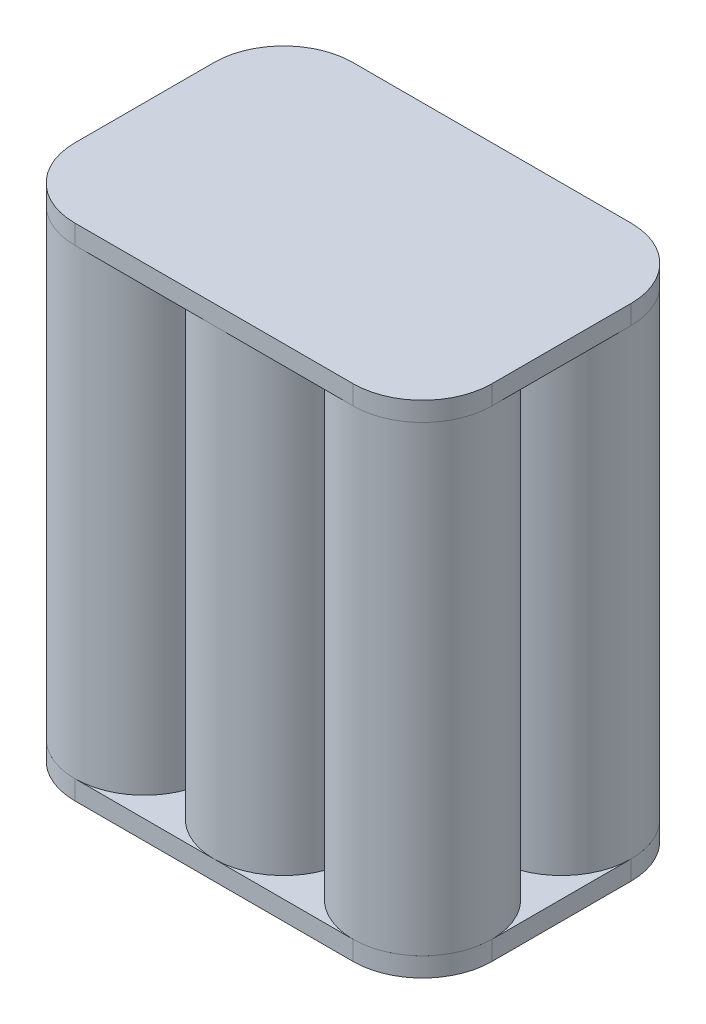
from build123d import *

# Parameters (mm, degrees)
SKETCH1_R             = 7.223333333
BOSS_EXTRUDE1_DEPTH   = 52
BOSS_EXTRUDE1_2_DEPTH = 52
BOSS_EXTRUDE1_3_DEPTH = 52
BOSS_EXTRUDE1_4_DEPTH = 52
BOSS_EXTRUDE1_5_DEPTH = 52
BOSS_EXTRUDE1_6_DEPTH = 52
SKETCH2_W             = 43.346666666
SKETCH2_H             = 28.896666666
BOSS_EXTRUDE2_DEPTH   = 2
SKETCH3_W             = 43.346666666
SKETCH3_H             = 28.896666666
BOSS_EXTRUDE3_DEPTH   = 2
FILLET1_R             = 7.22


with BuildPart() as part:
    # Sketch1 → Boss-Extrude1 (new body)
    with BuildSketch(Plane(origin=(0, 0, 0), x_dir=(1, 0, 0), z_dir=(0, 1, 0))):
        with Locations(Location((0, 0, 0), (0, 0, 90))):
            Circle(SKETCH1_R)
    extrude(amount=BOSS_EXTRUDE1_DEPTH)



with BuildPart() as body_2:
    # Sketch1 → Boss-Extrude1 2 (new body)
    with BuildSketch(Plane(origin=(0, 0, 0), x_dir=(1, 0, 0), z_dir=(0, 1, 0))):
        with Locations(Location((14.45, 0, 0), (0, 0, 90))):
            Circle(SKETCH1_R)
    extrude(amount=BOSS_EXTRUDE1_2_DEPTH)


with BuildPart() as body_3:
    # Sketch1 → Boss-Extrude1 3 (new body)
    with BuildSketch(Plane(origin=(0, 0, 0), x_dir=(1, 0, 0), z_dir=(0, 1, 0))):
        with Locations(Location((28.9, 0, 0), (0, 0, 90))):
            Circle(SKETCH1_R)
    extrude(amount=BOSS_EXTRUDE1_3_DEPTH)


with BuildPart() as body_4:
    # Sketch1 → Boss-Extrude1 4 (new body)
    with BuildSketch(Plane(origin=(0, 0, 0), x_dir=(1, 0, 0), z_dir=(0, 1, 0))):
        with Locations(Location((14.45, 14.45, 0), (0, 0, 90))):
            Circle(SKETCH1_R)
    extrude(amount=BOSS_EXTRUDE1_4_DEPTH)


with BuildPart() as body_5:
    # Sketch1 → Boss-Extrude1 5 (new body)
    with BuildSketch(Plane(origin=(0, 0, 0), x_dir=(1, 0, 0), z_dir=(0, 1, 0))):
        with Locations(Location((28.9, 14.45, 0), (0, 0, 90))):
            Circle(SKETCH1_R)
    extrude(amount=BOSS_EXTRUDE1_5_DEPTH)


with BuildPart() as body_6:
    # Sketch1 → Boss-Extrude1 6 (new body)
    with BuildSketch(Plane(origin=(0, 0, 0), x_dir=(1, 0, 0), z_dir=(0, 1, 0))):
        with Locations(Location((0, 14.45, 0), (0, 0, 90))):
            Circle(SKETCH1_R)
    extrude(amount=BOSS_EXTRUDE1_6_DEPTH)


with BuildPart() as part_1:
    add(part.part)

    add(body_2.part)  # Boss-Extrude2 merges body 2

    add(body_3.part)  # Boss-Extrude2 merges body 3

    add(body_4.part)  # Boss-Extrude2 merges body 4

    add(body_5.part)  # Boss-Extrude2 merges body 5

    add(body_6.part)  # Boss-Extrude2 merges body 6
    # Sketch2 → Boss-Extrude2 (add)
    with BuildSketch(Plane(origin=(0, 52, 0), x_dir=(1, 0, 0), z_dir=(0, 1, 0))):
        with Locations((14.45, 7.225)):
            Rectangle(SKETCH2_W, SKETCH2_H)
    extrude(amount=-BOSS_EXTRUDE2_DEPTH)

    # Sketch3 → Boss-Extrude3 (add)
    with BuildSketch(Plane.XZ):
        with Locations((14.45, -7.225)):
            Rectangle(SKETCH3_W, SKETCH3_H)
    extrude(amount=-BOSS_EXTRUDE3_DEPTH)

    # Fillet1
    fillet1_edges = [part_1.edges().sort_by_distance(p)[0] for p in [
        (36.123333333, 51, 7.223333333),
        (36.123333333, 1, 7.223333333),
        (-7.223333333, 51, 7.223333333),
        (-7.223333333, 1, 7.223333333),
        (-7.223333333, 51, -21.673333333),
        (36.123333333, 51, -21.673333333),
        (36.123333333, 1, -21.673333333),
        (-7.223333333, 1, -21.673333333),
    ]]
    fillet(fillet1_edges, radius=FILLET1_R)


solid = part_1.part
